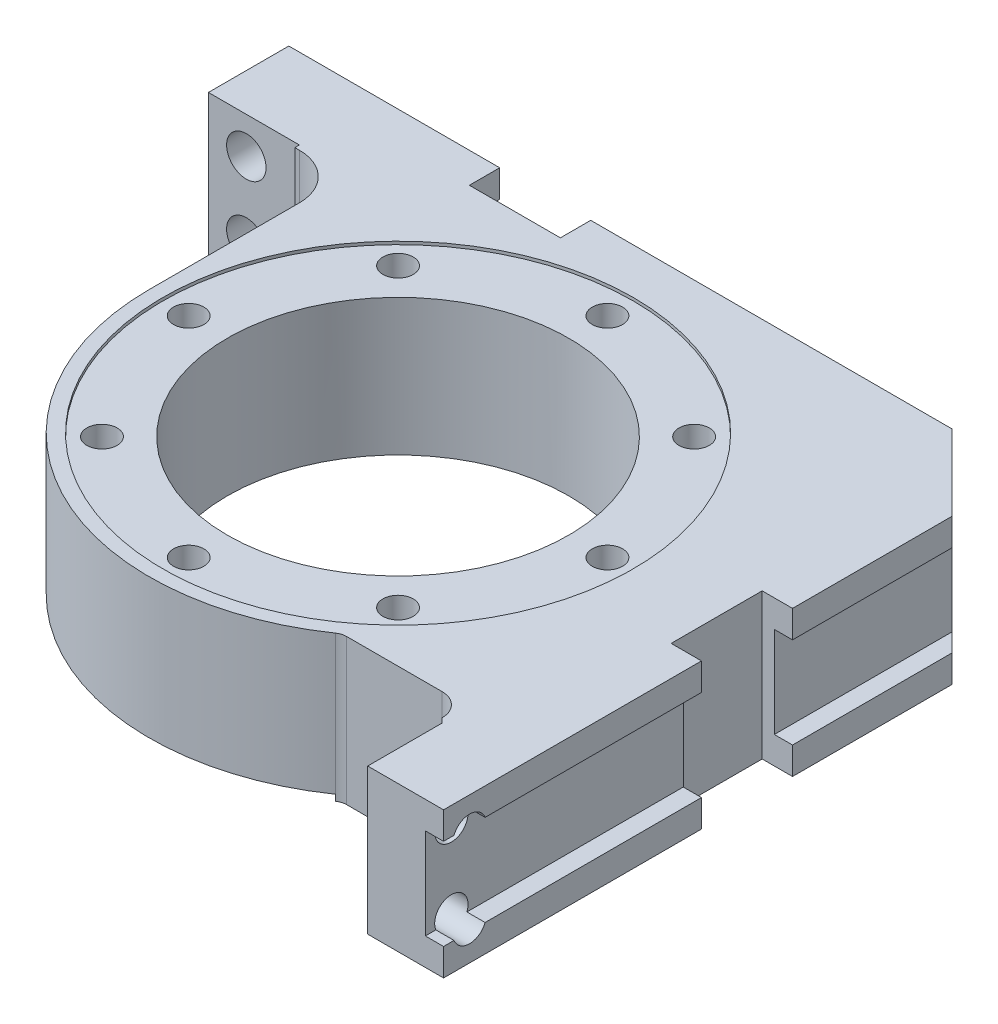
from build123d import *

# Parameters (mm, degrees)
BOSS_EXTRUDE1_DEPTH      = 96
BOSS_EXTRUDE2_START      = -96
SKETCH2_R                = 164
SKETCH2_R_2              = 112.5
BOSS_EXTRUDE2_DEPTH      = 96
SKETCH3_R                = 10
CUT_EXTRUDE2_DEPTH       = 22
CIRPATTERN1_COUNT        = 8
SKETCH4_R                = 8
CUT_EXTRUDE3_DEPTH       = 26
CIRPATTERN2_COUNT        = 8
FILLET1_R                = 10
CUT_EXTRUDE4_DEPTH       = 391.958919102
CUT_EXTRUDE4_DEPTH_BACK  = 391.958919102
CUT_EXTRUDE5_DEPTH       = 391.958919102
CUT_EXTRUDE5_DEPTH_BACK  = 2
SKETCH6_R                = 155
SKETCH7_R                = 164
CUT_EXTRUDE6_DEPTH       = 4
CUT_EXTRUDE7_DEPTH       = 391.958919102
CUT_EXTRUDE7_DEPTH_BACK  = 391.958919102
SKETCH8_W                = 24
SKETCH8_H                = 60
CUT_EXTRUDE8_DEPTH       = 470.945214053
CUT_EXTRUDE8_DEPTH_BACK  = 470.945214053
SKETCH9_W                = 24
SKETCH9_H                = 60
CUT_EXTRUDE9_DEPTH       = 530.537885533
CUT_EXTRUDE9_DEPTH_BACK  = 530.537885533
SKETCH10_R               = 11
CUT_EXTRUDE10_DEPTH      = 428.606716751
CUT_EXTRUDE10_DEPTH_BACK = 428.606716751
SKETCH11_R               = 13


with BuildPart() as part:
    # Sketch1 → Boss-Extrude1 (new body)
    with BuildSketch(Plane(origin=(0, 0, 0), x_dir=(1, 0, 0), z_dir=(0, 1, 0))):
        with BuildLine():
            Line((-96.191532686, 101.75916217), (-235.191532686, 101.75916217))
            Line((-235.191532686, 101.75916217), (-235.191532686, 48.75916217))
            Line((-235.191532686, 48.75916217), (-175.191532686, 48.75916217))
            Line((-175.191532686, 48.75916217), (-175.191532686, 45.75916217))
            Line((-175.191532686, 45.75916217), (-172.191532686, 45.75916217))
            ThreePointArc((-172.191532686, 45.75916217), (-150.978329251, 36.972365606), (-142.191532686, 15.75916217))
            Line((-142.191532686, 15.75916217), (-142.191532686, -83.24083783))
            ThreePointArc((-142.191532686, -83.24083783), (21.808467314, 80.75916217), (185.808467314, -83.24083783))
            ThreePointArc((185.808467314, -83.24083783), (167.8089992, -157.939195837), (117.761580864, -216.24083783))
            Line((117.761580864, -216.24083783), (183.808467314, -216.24083783))
            ThreePointArc((183.808467314, -216.24083783), (194.415069031, -220.634236112), (198.808467314, -231.24083783))
            Line((198.808467314, -231.24083783), (201.808467314, -234.24083783))
            Line((201.808467314, -234.24083783), (201.808467314, -283.24083783))
            Line((201.808467314, -283.24083783), (251.808467314, -283.24083783))
            Line((251.808467314, -283.24083783), (251.808467314, -113.24083783))
            Line((251.808467314, -113.24083783), (231.808467314, -113.24083783))
            Line((231.808467314, -113.24083783), (231.808467314, -53.24083783))
            Line((231.808467314, -53.24083783), (251.808467314, -53.24083783))
            Line((251.808467314, -53.24083783), (251.808467314, 45.75916217))
            Line((251.808467314, 45.75916217), (251.808467314, 101.75916217))
            Line((251.808467314, 101.75916217), (-36.191532686, 101.75916217))
            Line((-36.191532686, 101.75916217), (-36.191532686, 81.75916217))
            Line((-36.191532686, 81.75916217), (-96.191532686, 81.75916217))
            Line((-96.191532686, 81.75916217), (-96.191532686, 101.75916217))
        make_face()
    extrude(amount=BOSS_EXTRUDE1_DEPTH)

    # Sketch2 → Boss-Extrude2 (add)
    with BuildSketch(Plane(origin=(0, 96, 0), x_dir=(1, 0, 0), z_dir=(0, 1, 0)).offset(BOSS_EXTRUDE2_START)):
        with Locations((21.808467314, -83.24083783)):
            Circle(SKETCH2_R)
        with Locations(Location((21.808467314, -83.24083783, 0), (0, 0, 270))):
            Circle(SKETCH2_R_2, mode=Mode.SUBTRACT)
    extrude(amount=BOSS_EXTRUDE2_DEPTH)

    # Sketch3 → Cut-Extrude2 (cut)
    with BuildSketch(Plane(origin=(0, 96, 0), x_dir=(1, 0, 0), z_dir=(0, 1, 0))):
        with Locations(Location((21.808467314, 54.75916217, 0), (0, 0, 270))):
            Circle(SKETCH3_R)
    cut_extrude2 = extrude(amount=-CUT_EXTRUDE2_DEPTH, mode=Mode.SUBTRACT)

    # CirPattern1: Cut-Extrude2 ×8 about axis
    cirpattern1_axis = Axis((21.808467314, 0, 83.24083783), (0, 1, 0))
    for i in range(1, CIRPATTERN1_COUNT):
        add(cut_extrude2.rotate(cirpattern1_axis, i * 360 / CIRPATTERN1_COUNT), mode=Mode.SUBTRACT)

    # Sketch4 → Cut-Extrude3 (cut)
    with BuildSketch(Plane(origin=(0, 0, 0), x_dir=(-1, 0, 0), z_dir=(0, -1, 0))):
        with Locations(Location((-20.864768315, -218.23753939, 0), (0, 0, 90))):
            Circle(SKETCH4_R)
    cut_extrude3 = extrude(amount=-CUT_EXTRUDE3_DEPTH, mode=Mode.SUBTRACT)

    # CirPattern2: Cut-Extrude3 ×8 about axis
    cirpattern2_axis = Axis((21.808467314, 0, 83.24083783), (0, 1, 0))
    for i in range(1, CIRPATTERN2_COUNT):
        add(cut_extrude3.rotate(cirpattern2_axis, i * 360 / CIRPATTERN2_COUNT), mode=Mode.SUBTRACT)

    # Fillet1
    fillet1_edges = [part.edges().sort_by_distance(p)[0] for p in [
        (117.761580864, 48, 216.24083783),
    ]]
    fillet(fillet1_edges, radius=FILLET1_R)

    # Sketch5 → Cut-Extrude4 (cut, two sides: drawn at the far end of the back side and taken through both)
    with BuildSketch(Plane(origin=(0, 96, 0), x_dir=(1, 0, 0), z_dir=(0, 1, 0)).offset(-CUT_EXTRUDE4_DEPTH_BACK)):
        Polygon((251.808467314, 101.75916217), (201.808467314, 101.75916217), (251.808467314, 51.75916217), align=None)
    extrude(amount=CUT_EXTRUDE4_DEPTH + CUT_EXTRUDE4_DEPTH_BACK, mode=Mode.SUBTRACT)

    # Sketch6 → Cut-Extrude5 (cut, two sides: drawn at the far end of the back side and taken through both)
    with BuildSketch(Plane(origin=(0, 96, 0), x_dir=(1, 0, 0), z_dir=(0, 1, 0)).offset(-CUT_EXTRUDE5_DEPTH_BACK)):
        with Locations(Location((21.808467314, -83.24083783, 0), (0, 0, 90))):
            Circle(SKETCH6_R)
    extrude(amount=CUT_EXTRUDE5_DEPTH + CUT_EXTRUDE5_DEPTH_BACK, mode=Mode.SUBTRACT)

    # Sketch7 → Cut-Extrude6 (cut)
    with BuildSketch(Plane.XZ):
        with Locations((21.808467314, 83.24083783)):
            Circle(SKETCH7_R)
    extrude(amount=-CUT_EXTRUDE6_DEPTH, mode=Mode.SUBTRACT)

    # Sketch8 → Cut-Extrude7 (cut, two sides: drawn at the far end of the back side and taken through both)
    with BuildSketch(Plane(origin=(0, 0, 0), x_dir=(0, 0, -1), z_dir=(1, 0, 0)).offset(-CUT_EXTRUDE7_DEPTH_BACK)):
        with Locations((101.75916217, 48)):
            Rectangle(SKETCH8_W, SKETCH8_H)
    extrude(amount=CUT_EXTRUDE7_DEPTH + CUT_EXTRUDE7_DEPTH_BACK, mode=Mode.SUBTRACT)

    # Sketch9 → Cut-Extrude8 (cut, two sides: drawn at the far end of the back side and taken through both)
    with BuildSketch(Plane.XY.offset(283.24083783).offset(-CUT_EXTRUDE8_DEPTH_BACK)):
        with Locations((251.808467314, 48)):
            Rectangle(SKETCH9_W, SKETCH9_H)
    extrude(amount=CUT_EXTRUDE8_DEPTH + CUT_EXTRUDE8_DEPTH_BACK, mode=Mode.SUBTRACT)

    # Sketch10 → Cut-Extrude9 (cut, two sides: drawn at the far end of the back side and taken through both)
    with BuildSketch(Plane.ZY.offset(-201.808467314).offset(-CUT_EXTRUDE9_DEPTH_BACK)):
        with BuildLine():
            Line((266.100753095, 33), (266.100753095, 22))
            Line((266.100753095, 22), (277.100753095, 22))
            ThreePointArc((277.100753095, 22), (273.878927688, 29.778174593), (266.100753095, 33))
        make_face()
        with BuildLine():
            Line((277.100753095, 22), (266.100753095, 22))
            Line((266.100753095, 22), (266.100753095, 33))
            ThreePointArc((266.100753095, 33), (258.322578502, 14.221825407), (277.100753095, 22))
        make_face()
        with Locations(Location((266.100753095, 74, 0), (0, 0, 21.323686263))):
            Circle(SKETCH10_R)
    extrude(amount=CUT_EXTRUDE9_DEPTH + CUT_EXTRUDE9_DEPTH_BACK, mode=Mode.SUBTRACT)

    # Sketch11 → Cut-Extrude10 (cut, two sides: drawn at the far end of the back side and taken through both)
    with BuildSketch(Plane.XY.offset(-48.75916217).offset(-CUT_EXTRUDE10_DEPTH_BACK)):
        with Locations(Location((-210.191532686, 72, 0), (0, 0, 27.48642625))):
            Circle(SKETCH11_R)
        with Locations(Location((-210.191532686, 24, 0), (0, 0, 332.51357375))):
            Circle(SKETCH11_R)
    extrude(amount=CUT_EXTRUDE10_DEPTH + CUT_EXTRUDE10_DEPTH_BACK, mode=Mode.SUBTRACT)


solid = part.part
